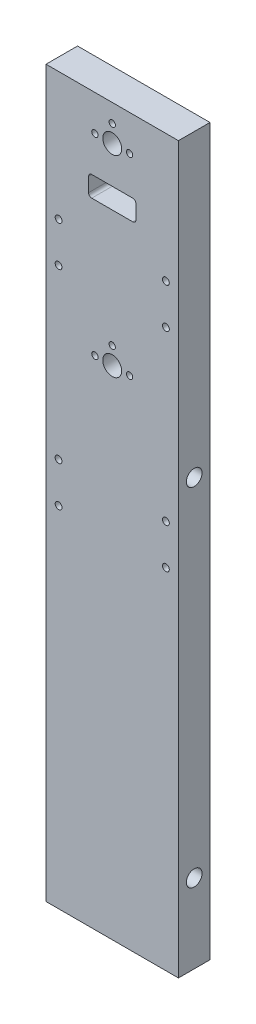
from build123d import *

# Parameters (mm, degrees)
SKETCH1_W           = 84
SKETCH1_H           = 460
SKETCH1_R           = 6
SKETCH1_R_2         = 2
BOSS_EXTRUDE1_DEPTH = 20
SKETCH2_R           = 5
CUT_EXTRUDE1_DEPTH  = 50
SKETCH4_R           = 2.159
CUT_EXTRUDE2_DEPTH  = 20
CUT_EXTRUDE3_DEPTH  = 20
SKETCH6_R           = 2.159
CUT_EXTRUDE4_DEPTH  = 20


with BuildPart() as part:
    # Sketch1 → Boss-Extrude1 (new body)
    with BuildSketch(Plane.XY):
        with Locations((0, -191.425)):
            Rectangle(SKETCH1_W, SKETCH1_H)
        with Locations((0, -106)):
            Circle(SKETCH1_R, mode=Mode.SUBTRACT)
        with Locations((11, -106)):
            Circle(SKETCH1_R_2, mode=Mode.SUBTRACT)
        with Locations((0, -95)):
            Circle(SKETCH1_R_2, mode=Mode.SUBTRACT)
        with Locations((0, 16)):
            Circle(SKETCH1_R, mode=Mode.SUBTRACT)
        with Locations((11, 16)):
            Circle(SKETCH1_R_2, mode=Mode.SUBTRACT)
        with Locations((-11, -106)):
            Circle(SKETCH1_R_2, mode=Mode.SUBTRACT)
        with Locations((0, 27)):
            Circle(SKETCH1_R_2, mode=Mode.SUBTRACT)
        with Locations((-11, 16)):
            Circle(SKETCH1_R_2, mode=Mode.SUBTRACT)
    extrude(amount=BOSS_EXTRUDE1_DEPTH)

    # Sketch2 → Cut-Extrude1 (cut, symmetric)
    with BuildSketch(Plane(origin=(0, 0, 0), x_dir=(0, 0, -1), z_dir=(1, 0, 0))):
        with Locations((-10, -151.425)):
            Circle(SKETCH2_R)
        with Locations((-10, -371.425)):
            Circle(SKETCH2_R)
    extrude(amount=CUT_EXTRUDE1_DEPTH, both=True, mode=Mode.SUBTRACT)

    # Sketch4 → Cut-Extrude2 (cut)
    with BuildSketch(Plane.XY):
        with Locations(Location((34.036, -42.557, 0), (0, 0, 180))):
            Circle(SKETCH4_R)
        with Locations(Location((34.036, -67.957, 0), (0, 0, 180))):
            Circle(SKETCH4_R)
        with Locations(Location((-34.036, -67.957, 0), (0, 0, 180))):
            Circle(SKETCH4_R)
        with Locations(Location((-34.036, -42.557, 0), (0, 0, 180))):
            Circle(SKETCH4_R)
    extrude(amount=CUT_EXTRUDE2_DEPTH, mode=Mode.SUBTRACT)

    # Sketch5 → Cut-Extrude3 (cut)
    with BuildSketch(Plane.XY):
        with BuildLine():
            Line((15, -18.4995), (15, -9.4995))
            ThreePointArc((15, -9.4995), (14.414213562, -8.085286438), (13, -7.4995))
            Line((13, -7.4995), (-13, -7.4995))
            ThreePointArc((-13, -7.4995), (-14.414213562, -8.085286438), (-15, -9.4995))
            Line((-15, -9.4995), (-15, -18.4995))
            ThreePointArc((-15, -18.4995), (-14.414213562, -19.913713562), (-13, -20.4995))
            Line((-13, -20.4995), (13, -20.4995))
            ThreePointArc((13, -20.4995), (14.414213562, -19.913713562), (15, -18.4995))
        make_face()
    extrude(amount=CUT_EXTRUDE3_DEPTH, mode=Mode.SUBTRACT)

    # Sketch6 → Cut-Extrude4 (cut)
    with BuildSketch(Plane.XY):
        with Locations((34.036, -174.558)):
            Circle(SKETCH6_R)
        with Locations((-34.036, -174.558)):
            Circle(SKETCH6_R)
        with Locations((-34.036, -199.958)):
            Circle(SKETCH6_R)
        with Locations((34.036, -199.958)):
            Circle(SKETCH6_R)
    extrude(amount=CUT_EXTRUDE4_DEPTH, mode=Mode.SUBTRACT)


solid = part.part
